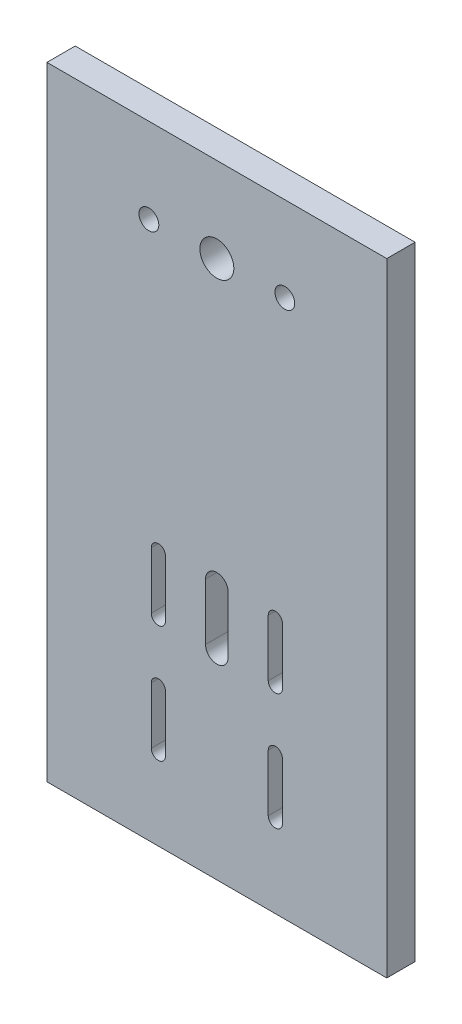
from build123d import *

# Parameters (mm, degrees)
SKETCH1_W           = 120
SKETCH1_H           = 220
SKETCH1_R           = 6
SKETCH1_R_2         = 3.5
BOSS_EXTRUDE1_DEPTH = 10


with BuildPart() as part:
    # Sketch1 → Boss-Extrude1 (new body)
    with BuildSketch(Plane.XY):
        with Locations((0, -94.764397906)):
            Rectangle(SKETCH1_W, SKETCH1_H)
        with Locations((0, -14.764397906)):
            Circle(SKETCH1_R, mode=Mode.SUBTRACT)
        with Locations((24, -14.764397906)):
            Circle(SKETCH1_R_2, mode=Mode.SUBTRACT)
        with Locations(Location((-24, -14.764397906, 0), (0, 0, 180))):
            Circle(SKETCH1_R_2, mode=Mode.SUBTRACT)
        with BuildLine():
            Line((4, -114.764397906), (4, -134.764397906))
            ThreePointArc((4, -134.764397906), (0, -138.764397906), (-4, -134.764397906))
            Line((-4, -134.764397906), (-4, -114.764397906))
            ThreePointArc((-4, -114.764397906), (0, -110.764397906), (4, -114.764397906))
        make_face(mode=Mode.SUBTRACT)
        with BuildLine():
            Line((23.15, -114.764397906), (23.15, -134.764397906))
            ThreePointArc((23.15, -134.764397906), (20.65, -137.264397906), (18.15, -134.764397906))
            Line((18.15, -134.764397906), (18.15, -114.764397906))
            ThreePointArc((18.15, -114.764397906), (20.65, -112.264397906), (23.15, -114.764397906))
        make_face(mode=Mode.SUBTRACT)
        with BuildLine():
            Line((-23.15, -114.764397906), (-23.15, -134.764397906))
            ThreePointArc((-23.15, -134.764397906), (-20.65, -137.264397906), (-18.15, -134.764397906))
            Line((-18.15, -134.764397906), (-18.15, -114.764397906))
            ThreePointArc((-18.15, -114.764397906), (-20.65, -112.264397906), (-23.15, -114.764397906))
        make_face(mode=Mode.SUBTRACT)
        with BuildLine():
            Line((-23.15, -176.064397906), (-23.15, -156.064397906))
            ThreePointArc((-23.15, -156.064397906), (-20.65, -153.564397906), (-18.15, -156.064397906))
            Line((-18.15, -156.064397906), (-18.15, -176.064397906))
            ThreePointArc((-18.15, -176.064397906), (-20.65, -178.564397906), (-23.15, -176.064397906))
        make_face(mode=Mode.SUBTRACT)
        with BuildLine():
            Line((23.15, -176.064397906), (23.15, -156.064397906))
            ThreePointArc((23.15, -156.064397906), (20.65, -153.564397906), (18.15, -156.064397906))
            Line((18.15, -156.064397906), (18.15, -176.064397906))
            ThreePointArc((18.15, -176.064397906), (20.65, -178.564397906), (23.15, -176.064397906))
        make_face(mode=Mode.SUBTRACT)
    extrude(amount=BOSS_EXTRUDE1_DEPTH)


solid = part.part
